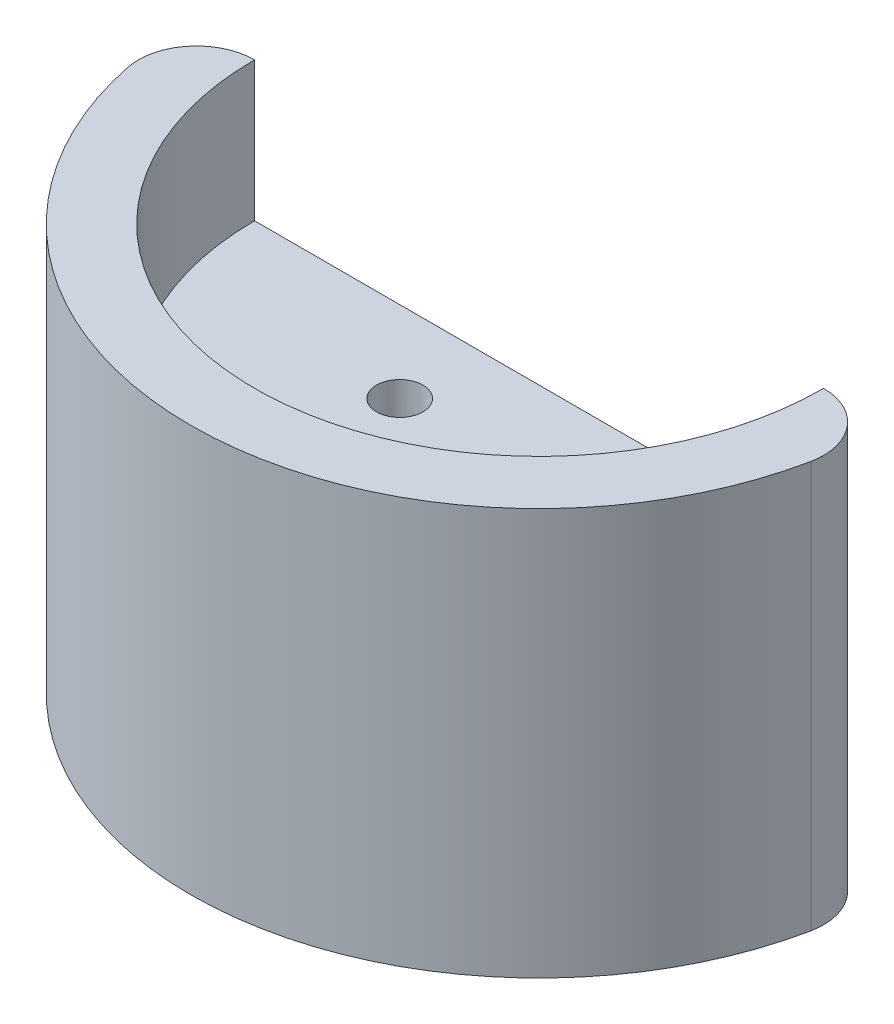
from build123d import *

# Parameters (mm, degrees)
BOSS_EXTRUDE1_DEPTH = 5
BOSS_EXTRUDE2_DEPTH = 15
BOSS_EXTRUDE3_START = 15
BOSS_EXTRUDE3_DEPTH = 15
FILLET2_R           = 5
FILLET3_R           = 5
CUT_EXTRUDE1_DEPTH  = 12
CUT_EXTRUDE2_START  = -12
CUT_EXTRUDE2_DEPTH  = 12
SKETCH11_R          = 2
CUT_EXTRUDE3_DEPTH  = 11


with BuildPart() as part:
    # Sketch4 → Boss-Extrude1 (new body)
    with BuildSketch(Plane(origin=(0, 0, 0), x_dir=(1, 0, 0), z_dir=(0, 1, 0))):
        with BuildLine():
            Line((-57.478675123, 14.203833226), (-47.478675123, 14.203833226))
            ThreePointArc((-47.478675123, 14.203833226), (-32.478675123, -0.796166774), (-17.478675123, 14.203833226))
            Line((-17.478675123, 14.203833226), (2.521324877, 14.203833226))
            ThreePointArc((2.521324877, 14.203833226), (-27.478675123, -15.796166774), (-57.478675123, 14.203833226))
        make_face()
    extrude(amount=BOSS_EXTRUDE1_DEPTH)

    # Sketch5 → Boss-Extrude2 (add)
    with BuildSketch(Plane(origin=(0, 5, 0), x_dir=(1, 0, 0), z_dir=(0, 1, 0))):
        with BuildLine():
            Line((-57.478675123, 14.203833226), (2.521324877, 14.203833226))
            ThreePointArc((2.521324877, 14.203833226), (-27.478675123, -15.796166774), (-57.478675123, 14.203833226))
        make_face()
    extrude(amount=BOSS_EXTRUDE2_DEPTH)

    # Sketch6 → Boss-Extrude3 (add)
    with BuildSketch(Plane.XZ.offset(BOSS_EXTRUDE3_START)):
        with BuildLine():
            Line((2.521324877, -14.203833226), (-57.478675123, -14.203833226))
            ThreePointArc((-57.478675123, -14.203833226), (-27.478675123, 15.796166774), (2.521324877, -14.203833226))
        make_face()
    extrude(amount=-BOSS_EXTRUDE3_DEPTH)

    # Fillet2
    fillet2_edges = [part.edges().sort_by_distance(p)[0] for p in [
        (2.521324877, 2.5, -14.203833226),
    ]]
    fillet(fillet2_edges, radius=FILLET2_R)

    # Fillet3
    fillet3_edges = [part.edges().sort_by_distance(p)[0] for p in [
        (-57.478675123, 2.5, -14.203833226),
    ]]
    fillet(fillet3_edges, radius=FILLET3_R)

    # Sketch8 → Cut-Extrude1 (cut)
    with BuildSketch(Plane(origin=(0, 20, 0), x_dir=(1, 0, 0), z_dir=(0, 1, 0))):
        with BuildLine():
            Line((-51.973572551, 14.203833226), (-2.983777696, 14.203833226))
            ThreePointArc((-2.983777696, 14.203833226), (-27.478675123, -10.291064201), (-51.973572551, 14.203833226))
        make_face()
    extrude(amount=-CUT_EXTRUDE1_DEPTH, mode=Mode.SUBTRACT)

    # Sketch9 → Cut-Extrude2 (cut)
    with BuildSketch(Plane.XZ.offset(15).offset(CUT_EXTRUDE2_START)):
        with BuildLine():
            Line((-51.973572551, -14.203833226), (-2.983777696, -14.203833226))
            ThreePointArc((-2.983777696, -14.203833226), (-27.478675123, 10.291064201), (-51.973572551, -14.203833226))
        make_face()
    extrude(amount=CUT_EXTRUDE2_DEPTH, mode=Mode.SUBTRACT)

    # Sketch11 → Cut-Extrude3 (cut)
    with BuildSketch(Plane.XZ.offset(3)):
        with Locations(Location((-32.478675123, -7.203833226, 0), (0, 0, 270))):
            Circle(SKETCH11_R)
    extrude(amount=-CUT_EXTRUDE3_DEPTH, mode=Mode.SUBTRACT)


solid = part.part
